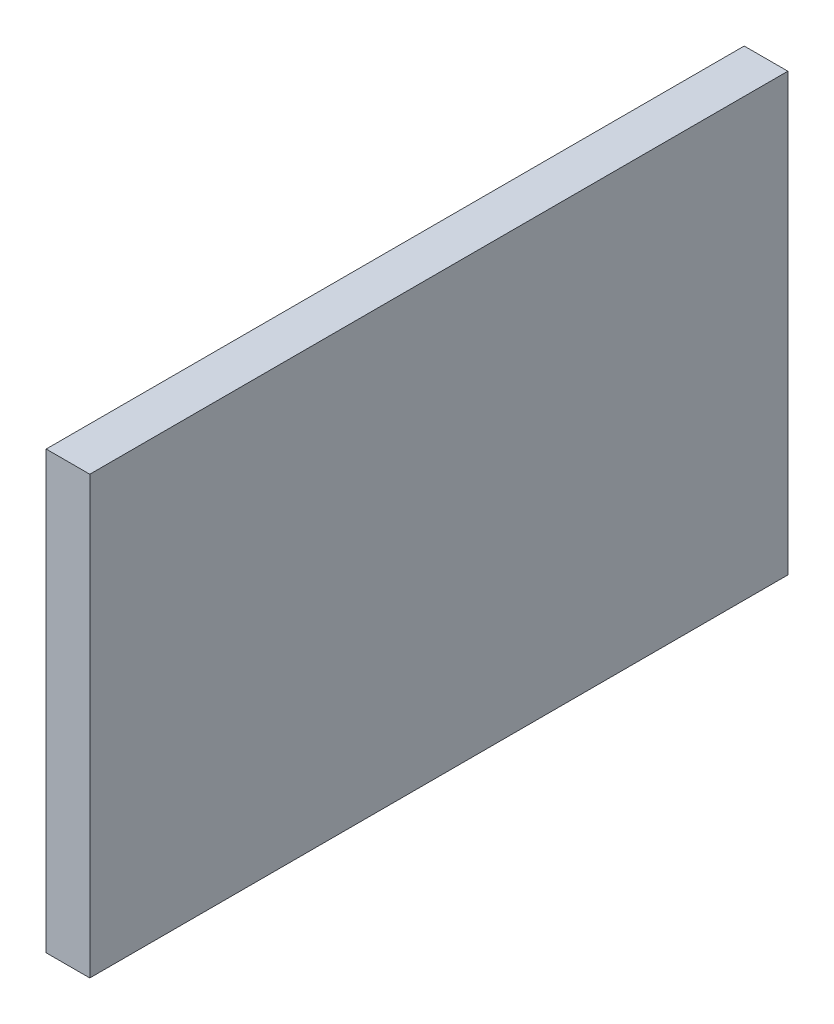
from build123d import *

# Parameters (mm, degrees)
SKETCH1_W           = 200
SKETCH1_H           = 3200
BOSS_EXTRUDE1_DEPTH = 2000


with BuildPart() as part:
    # Sketch1 → Boss-Extrude1 (new body)
    with BuildSketch(Plane(origin=(0, 0, 0), x_dir=(1, 0, 0), z_dir=(0, 1, 0))):
        Rectangle(SKETCH1_W, SKETCH1_H)
    extrude(amount=BOSS_EXTRUDE1_DEPTH)


solid = part.part
